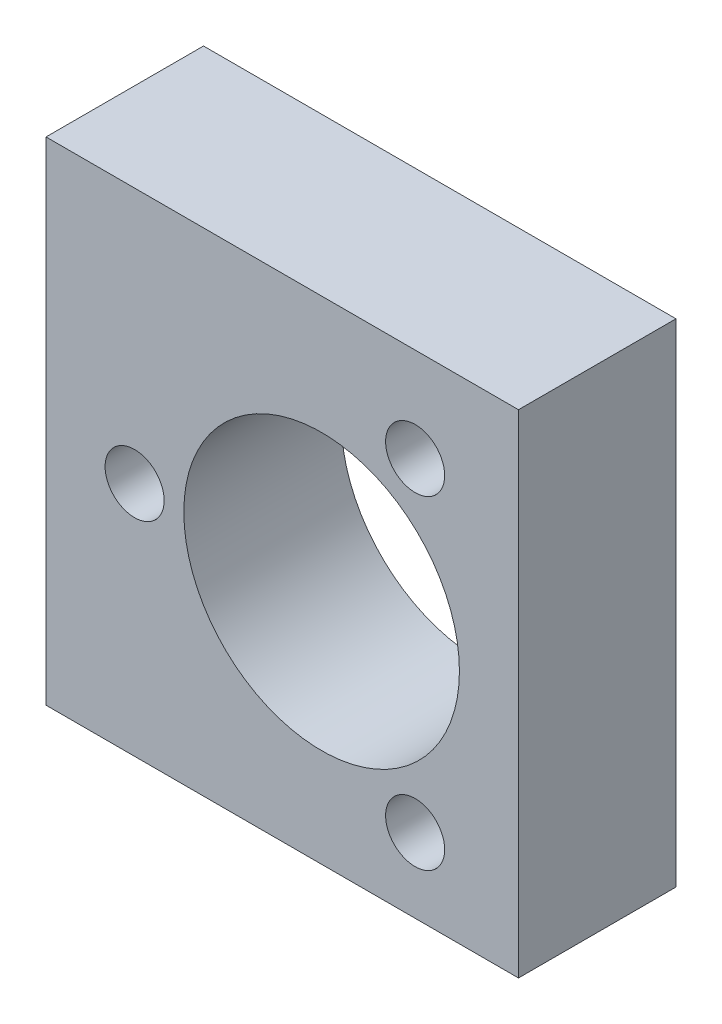
from build123d import *

# Parameters (mm, degrees)
ESQUISSE1_W        = 24
ESQUISSE1_H        = 25
ESQUISSE1_R        = 7
ESQUISSE1_R_2      = 1.5
BOSS_EXTRU_1_DEPTH = 8


with BuildPart() as part:
    # Esquisse1 → Boss.-Extru.1 (new body)
    with BuildSketch(Plane.XY):
        with Locations((12, 12.5)):
            Rectangle(ESQUISSE1_W, ESQUISSE1_H)
        with Locations((14, 12)):
            Circle(ESQUISSE1_R, mode=Mode.SUBTRACT)
        with Locations((4.5, 12)):
            Circle(ESQUISSE1_R_2, mode=Mode.SUBTRACT)
        with Locations((18.75, 20.227241336)):
            Circle(ESQUISSE1_R_2, mode=Mode.SUBTRACT)
        with Locations((18.75, 3.772758664)):
            Circle(ESQUISSE1_R_2, mode=Mode.SUBTRACT)
    extrude(amount=BOSS_EXTRU_1_DEPTH)


solid = part.part
